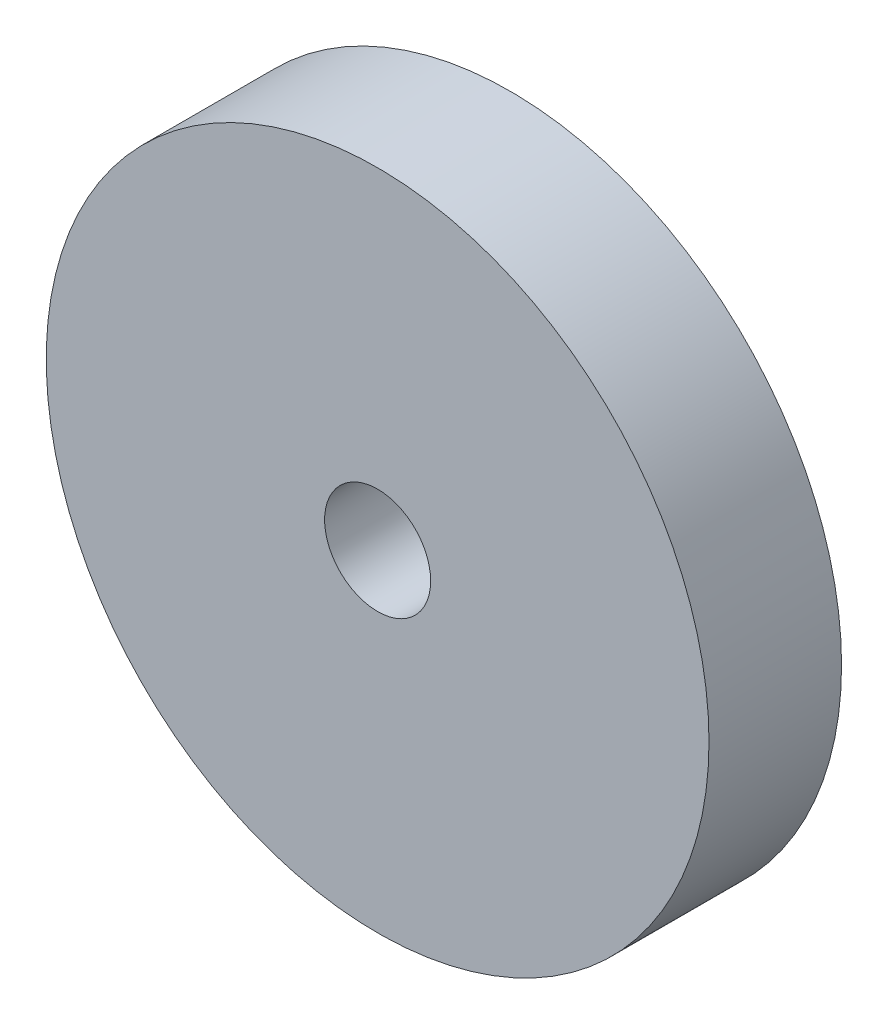
from build123d import *

# Parameters (mm, degrees)
CROQUIS1_R              = 25
CROQUIS1_R_2            = 4
SALIENTE_EXTRUIR1_DEPTH = 5


with BuildPart() as part:
    # Croquis1 → Saliente-Extruir1 (new, symmetric)
    with BuildSketch(Plane.XY):
        Circle(CROQUIS1_R)
        Circle(CROQUIS1_R_2, mode=Mode.SUBTRACT)
    extrude(amount=SALIENTE_EXTRUIR1_DEPTH, both=True)


solid = part.part
